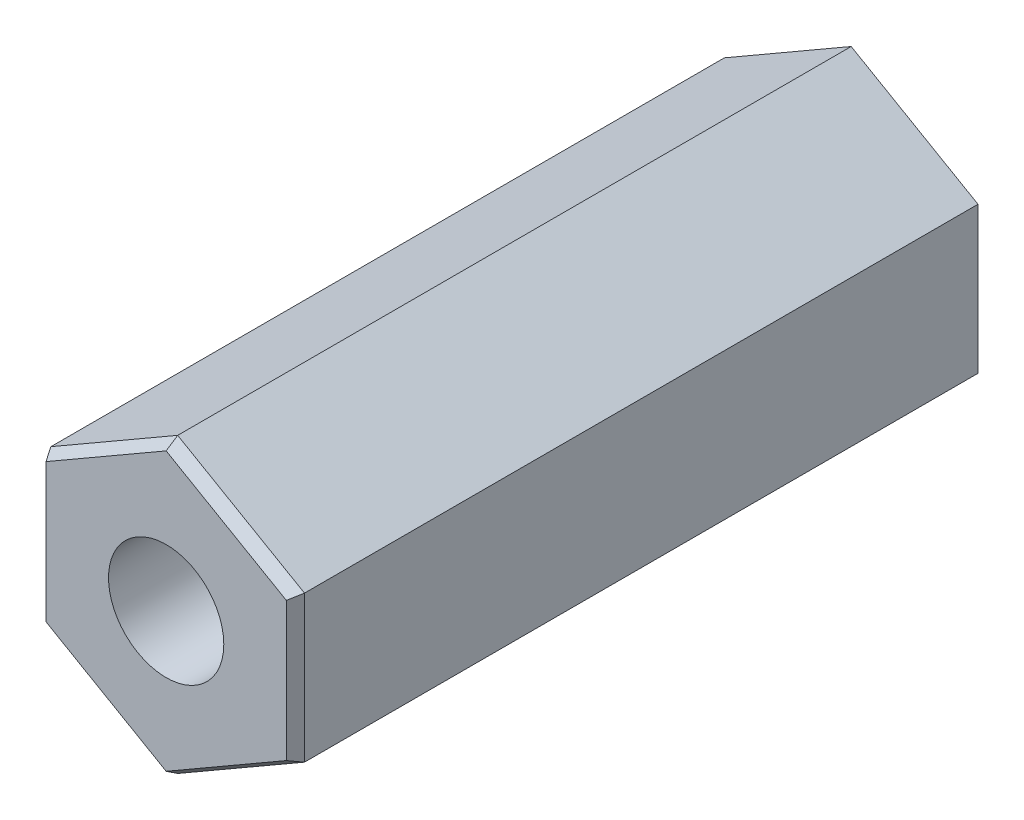
from build123d import *
from OCP.BRepFilletAPI import BRepFilletAPI_MakeChamfer

# Parameters (mm, degrees)
EXTRUDE_1_DEPTH    = 7.5
HOLE_WIZARD_M3_1_D = 2.5
CHAMFER_2_SIZE     = 0.25
CHAMFER_2_SIZE2    = 0.144337567


with BuildPart() as part:
    # ｽｹｯﾁ1 → ﾎﾞｽ - 押し出し1 (new, symmetric)
    with BuildSketch(Plane.XY):
        Polygon((-2.75, 1.58771324), (-2.75, -1.58771324), (0, -3.175426481), (2.75, -1.58771324), (2.75, 1.58771324), (0, 3.175426481), align=None)
    extrude(amount=EXTRUDE_1_DEPTH, both=True)

    # M3 ねじ穴1 (through all)
    with Locations(Plane.XY.offset(7.5)):
        with Locations((0, 0)):
            Hole(HOLE_WIZARD_M3_1_D / 2)

    # 面取り2: one chamfer whose edges measure the first distance from different faces: ONE call of the kernel's chamfer builder (chamfer() names one face for all edges)
    chamfer_2_edges_1 = [part.edges().sort_by_distance(p)[0] for p in [
        (-1.375, -2.38156986, 7.5),
    ]]
    chamfer_2_side_1 = [part.faces().sort_by_distance(p)[0] for p in [
        (-1.375, -2.38156986, 0),
    ]]
    chamfer_2_edges_2 = [part.edges().sort_by_distance(p)[0] for p in [
        (1.375, -2.38156986, 7.5),
    ]]
    chamfer_2_side_2 = [part.faces().sort_by_distance(p)[0] for p in [
        (1.375, -2.38156986, 0),
    ]]
    chamfer_2_edges_3 = [part.edges().sort_by_distance(p)[0] for p in [
        (2.75, 0, 7.5),
    ]]
    chamfer_2_side_3 = [part.faces().sort_by_distance(p)[0] for p in [
        (2.75, 0, 0),
    ]]
    chamfer_2_edges_4 = [part.edges().sort_by_distance(p)[0] for p in [
        (1.375, 2.38156986, 7.5),
    ]]
    chamfer_2_side_4 = [part.faces().sort_by_distance(p)[0] for p in [
        (1.375, 2.38156986, 0),
    ]]
    chamfer_2_edges_5 = [part.edges().sort_by_distance(p)[0] for p in [
        (-1.375, 2.38156986, 7.5),
    ]]
    chamfer_2_side_5 = [part.faces().sort_by_distance(p)[0] for p in [
        (-1.375, 2.38156986, 0),
    ]]
    chamfer_2_edges_6 = [part.edges().sort_by_distance(p)[0] for p in [
        (1.375, 2.38156986, -7.5),
        (2.75, 0, -7.5),
        (1.375, -2.38156986, -7.5),
        (-1.375, -2.38156986, -7.5),
        (-2.75, 0, -7.5),
        (-1.375, 2.38156986, -7.5),
    ]]
    chamfer_2_side_6 = [part.faces().sort_by_distance(p)[0] for p in [
        (-2.665986112, 0, -7.5),
    ]]
    chamfer_2_edges_7 = [part.edges().sort_by_distance(p)[0] for p in [
        (-2.75, 0, 7.5),
    ]]
    chamfer_2_side_7 = [part.faces().sort_by_distance(p)[0] for p in [
        (-2.75, 0, 0),
    ]]
    chamfer_2 = BRepFilletAPI_MakeChamfer(part.part.solid().wrapped)
    for e in chamfer_2_edges_1:
        chamfer_2.Add(CHAMFER_2_SIZE, CHAMFER_2_SIZE2, e.wrapped, chamfer_2_side_1[0].wrapped)  # the first distance lies on this face
    for e in chamfer_2_edges_2:
        chamfer_2.Add(CHAMFER_2_SIZE, CHAMFER_2_SIZE2, e.wrapped, chamfer_2_side_2[0].wrapped)  # the first distance lies on this face
    for e in chamfer_2_edges_3:
        chamfer_2.Add(CHAMFER_2_SIZE, CHAMFER_2_SIZE2, e.wrapped, chamfer_2_side_3[0].wrapped)  # the first distance lies on this face
    for e in chamfer_2_edges_4:
        chamfer_2.Add(CHAMFER_2_SIZE, CHAMFER_2_SIZE2, e.wrapped, chamfer_2_side_4[0].wrapped)  # the first distance lies on this face
    for e in chamfer_2_edges_5:
        chamfer_2.Add(CHAMFER_2_SIZE, CHAMFER_2_SIZE2, e.wrapped, chamfer_2_side_5[0].wrapped)  # the first distance lies on this face
    for e in chamfer_2_edges_6:
        chamfer_2.Add(CHAMFER_2_SIZE, CHAMFER_2_SIZE2, e.wrapped, chamfer_2_side_6[0].wrapped)  # the first distance lies on this face
    for e in chamfer_2_edges_7:
        chamfer_2.Add(CHAMFER_2_SIZE, CHAMFER_2_SIZE2, e.wrapped, chamfer_2_side_7[0].wrapped)  # the first distance lies on this face
    add(Compound.cast(chamfer_2.Shape()), mode=Mode.REPLACE)


solid = part.part
